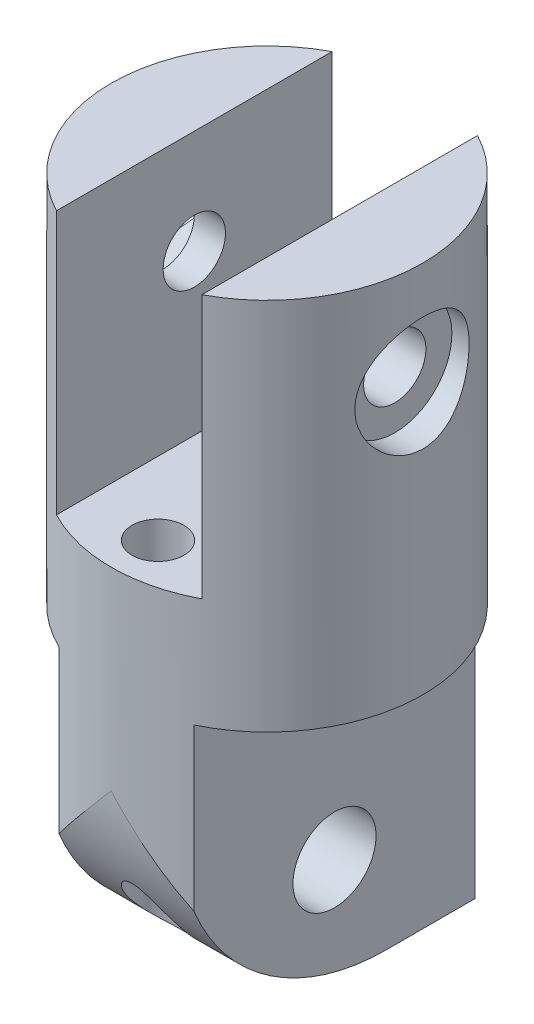
from build123d import *

# Parameters (mm, degrees)
SKETCH1_W           = 6.5
SKETCH1_H           = 14
BOSS_EXTRUDE1_DEPTH = 15
FILLET1_R           = 10
SKETCH2_R           = 2
CUT_EXTRUDE1_DEPTH  = 18.783419244
SKETCH4_R           = 7.5
BOSS_EXTRUDE2_DEPTH = 18
SKETCH6_W           = 7
SKETCH6_H           = 12.68
CUT_EXTRUDE2_DEPTH  = 31.103986447
CUT_EXTRUDE3_DEPTH  = 25.6018292
SKETCH8_R           = 1.5
CUT_EXTRUDE4_DEPTH  = 21
SKETCH9_R           = 2.75
CUT_EXTRUDE5_DEPTH  = 10
CUT_EXTRUDE6_DEPTH  = 10
SKETCH11_R          = 1.25
CUT_EXTRUDE7_DEPTH  = 24


with BuildPart() as part:
    # Sketch1 → Boss-Extrude1 (new body)
    with BuildSketch(Plane.XY):
        Rectangle(SKETCH1_W, SKETCH1_H)
    extrude(amount=BOSS_EXTRUDE1_DEPTH)

    # Fillet1
    fillet1_edges = [part.edges().sort_by_distance(p)[0] for p in [
        (0, -7, 15),
    ]]
    fillet(fillet1_edges, radius=FILLET1_R)

    # Sketch2 → Cut-Extrude1 (cut, through all)
    with BuildSketch(Plane(origin=(3.25, 0, 0), x_dir=(0, 0, -1), z_dir=(1, 0, 0))):
        with Locations((-7.5, -2)):
            Circle(SKETCH2_R)
    extrude(amount=-CUT_EXTRUDE1_DEPTH, mode=Mode.SUBTRACT)

    # Sketch4 → Boss-Extrude2 (add)
    with BuildSketch(Plane(origin=(0, 7, 0), x_dir=(1, 0, 0), z_dir=(0, 1, 0))):
        with Locations((0, -7.5)):
            Circle(SKETCH4_R)
    extrude(amount=BOSS_EXTRUDE2_DEPTH)

    # Sketch6 → Cut-Extrude2 (cut, through all)
    with BuildSketch(Plane(origin=(0, 0, 0), x_dir=(-1, 0, 0), z_dir=(0, 0, -1))):
        with Locations((0, 18.66)):
            Rectangle(SKETCH6_W, SKETCH6_H)
    extrude(amount=-CUT_EXTRUDE2_DEPTH, mode=Mode.SUBTRACT)

    # Sketch7 → Cut-Extrude3 (cut, through all)
    with BuildSketch(Plane(origin=(0, 7, 0), x_dir=(1, 0, 0), z_dir=(0, 1, 0))):
        with BuildLine():
            ThreePointArc((0, -15), (-1.666673801, -14.812468697), (-3.25, -14.259252917))
            Line((-3.25, -14.259252917), (-3.25, -15))
            Line((-3.25, -15), (0, -15))
        make_face()
        with BuildLine():
            ThreePointArc((3.25, -14.259252917), (1.666673801, -14.812468697), (0, -15))
            Line((0, -15), (3.25, -15))
            Line((3.25, -15), (3.25, -14.259252917))
        make_face()
        with BuildLine():
            ThreePointArc((-3.25, -0.740747083), (-1.666673801, -0.187531303), (0, 0))
            Line((0, 0), (-3.25, 0))
            Line((-3.25, 0), (-3.25, -0.740747083))
        make_face()
        with BuildLine():
            Line((3.25, 0), (0, 0))
            ThreePointArc((0, 0), (1.666673801, -0.187531303), (3.25, -0.740747083))
            Line((3.25, -0.740747083), (3.25, 0))
        make_face()
    extrude(amount=-CUT_EXTRUDE3_DEPTH, mode=Mode.SUBTRACT)

    # Sketch8 → Cut-Extrude4 (cut, symmetric)
    with BuildSketch(Plane(origin=(-3.5, 0, 0), x_dir=(0, 0, -1), z_dir=(1, 0, 0))):
        with Locations((-7.5, 20)):
            Circle(SKETCH8_R)
    extrude(amount=CUT_EXTRUDE4_DEPTH, both=True, mode=Mode.SUBTRACT)

    # Sketch9 → Cut-Extrude5 (cut)
    with BuildSketch(Plane.ZY.offset(-6.15)):
        with Locations((7.5, 20)):
            Circle(SKETCH9_R)
    extrude(amount=-CUT_EXTRUDE5_DEPTH, mode=Mode.SUBTRACT)

    # Sketch10 → Cut-Extrude6 (cut)
    with BuildSketch(Plane(origin=(-5, 0, 0), x_dir=(0, 0, -1), z_dir=(1, 0, 0))):
        Polygon((-7.5, 23.75277675), (-10.75, 21.876388375), (-10.75, 18.123611625), (-7.5, 16.24722325), (-4.25, 18.123611625), (-4.25, 21.876388375), align=None)
    extrude(amount=-CUT_EXTRUDE6_DEPTH, mode=Mode.SUBTRACT)

    # Sketch11 → Cut-Extrude7 (cut)
    with BuildSketch(Plane.XZ.offset(7)):
        with Locations((0, 3)):
            Circle(SKETCH11_R)
        with Locations((0, 12.74882624)):
            Circle(SKETCH11_R)
    extrude(amount=-CUT_EXTRUDE7_DEPTH, mode=Mode.SUBTRACT)


solid = part.part
